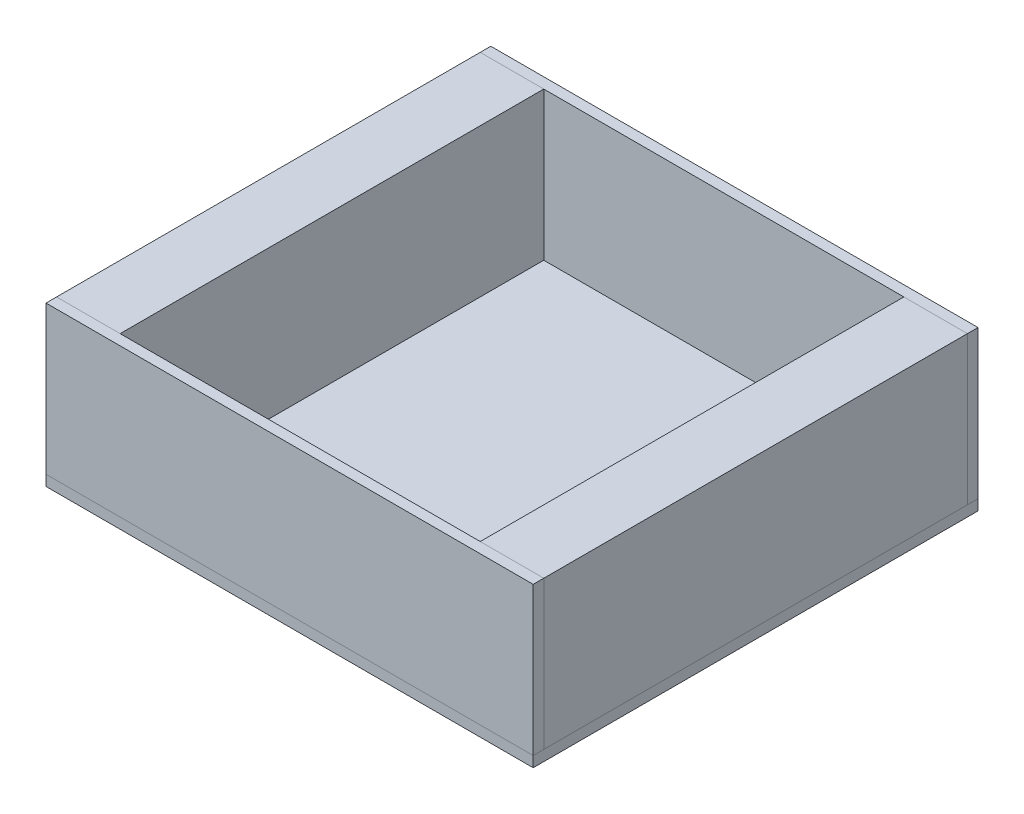
from build123d import *

# Parameters (mm, degrees)
SKETCH1_W             = 38.1
SKETCH1_H             = 88.9
BOSS_EXTRUDE1_DEPTH   = 254
BOSS_EXTRUDE1_2_DEPTH = 254
SKETCH2_W             = 292.1
SKETCH2_H             = 88.9
BOSS_EXTRUDE2_DEPTH   = 6.35
BOSS_EXTRUDE3_START   = 254
SKETCH2_2_W           = 292.1
SKETCH2_2_H           = 88.9
BOSS_EXTRUDE3_DEPTH   = 6.35
BOSS_EXTRUDE4_START   = -44.45
SKETCH3_W             = 292.1
SKETCH3_H             = 266.7
BOSS_EXTRUDE4_DEPTH   = 6.35


with BuildPart() as part:
    # Sketch1 → Boss-Extrude1 (new body)
    with BuildSketch(Plane.XY):
        Rectangle(SKETCH1_W, SKETCH1_H)
    extrude(amount=BOSS_EXTRUDE1_DEPTH)


with BuildPart() as body_2:
    # Sketch1 → Boss-Extrude1 2 (new body)
    with BuildSketch(Plane.XY):
        with Locations((254, 0)):
            Rectangle(SKETCH1_W, SKETCH1_H)
    extrude(amount=BOSS_EXTRUDE1_2_DEPTH)


with BuildPart() as body_3:
    # Sketch2 → Boss-Extrude2 (new body)
    with BuildSketch(Plane.XY):
        with Locations((127, 0)):
            Rectangle(SKETCH2_W, SKETCH2_H)
    extrude(amount=-BOSS_EXTRUDE2_DEPTH)


with BuildPart() as body_4:
    # Sketch2<2> → Boss-Extrude3 (new body)
    with BuildSketch(Plane.XY.offset(BOSS_EXTRUDE3_START)):
        with Locations((127, 0)):
            Rectangle(SKETCH2_2_W, SKETCH2_2_H)
    extrude(amount=BOSS_EXTRUDE3_DEPTH)


with BuildPart() as body_5:
    # Sketch3 → Boss-Extrude4 (new body)
    with BuildSketch(Plane(origin=(0, 0, 0), x_dir=(1, 0, 0), z_dir=(0, 1, 0)).offset(BOSS_EXTRUDE4_START)):
        with Locations((127, -127)):
            Rectangle(SKETCH3_W, SKETCH3_H)
    extrude(amount=-BOSS_EXTRUDE4_DEPTH)


solid = Compound([part.part, body_2.part, body_3.part, body_4.part, body_5.part])
